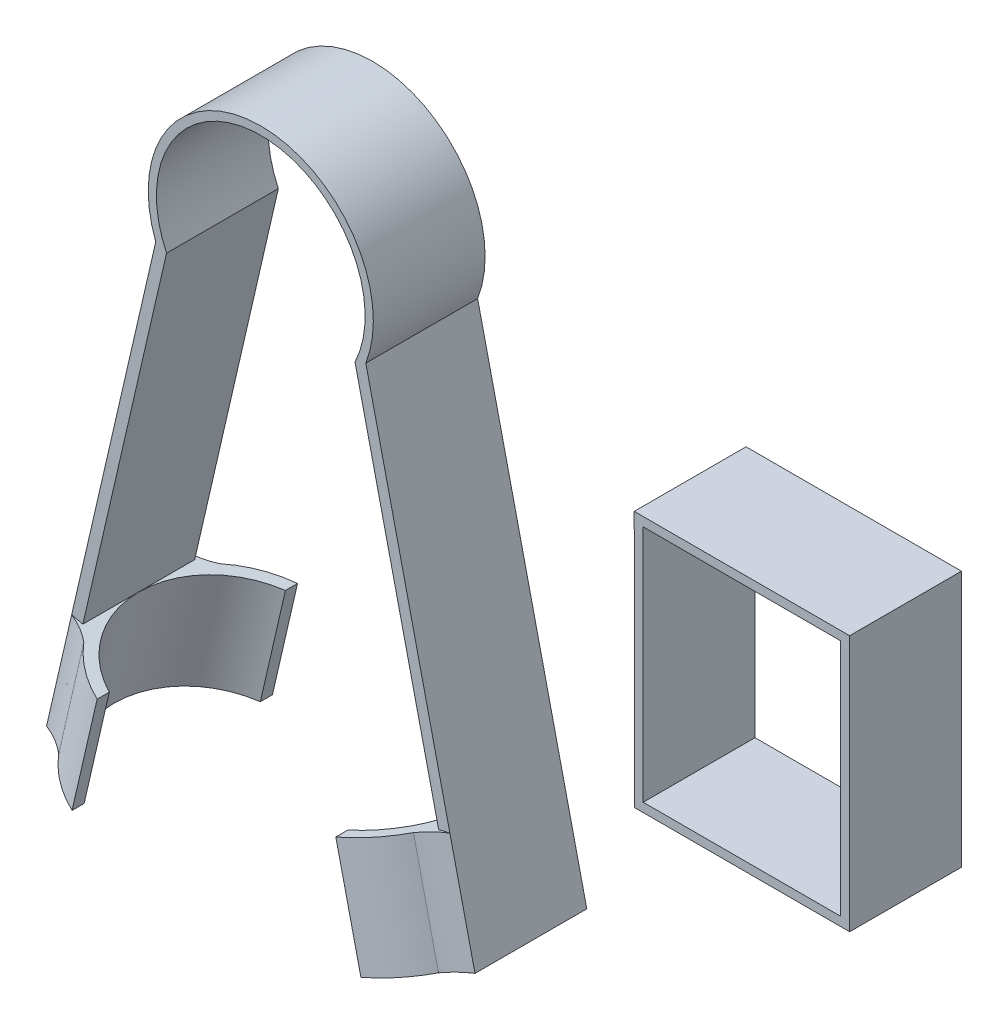
from build123d import *

# Parameters (mm, degrees)
BOSS_EXTRUDE1_DEPTH = 15
SKETCH2_W           = 1.545443363
SKETCH2_H           = 15
BOSS_EXTRUDE2_DEPTH = 15
SKETCH3_W           = 1.545443364
SKETCH3_H           = 15
BOSS_EXTRUDE3_DEPTH = 15
SKETCH4_W           = 26.5
SKETCH4_H           = 32
BOSS_EXTRUDE4_DEPTH = 15


with BuildPart() as part:
    # Sketch1 → Boss-Extrude1 (new body)
    with BuildSketch(Plane.XY):
        with BuildLine():
            ThreePointArc((17.78047381, -1.842873049), (3.687593803, 18.679371239), (-10.405286203, -1.842873049))
            Line((-10.405286203, -1.842873049), (-21.685752651, -50.81039406))
            Line((-21.685752651, -50.81039406), (-20.179753399, -51.157325529))
            Line((-20.179753399, -51.157325529), (-8.95541876, -2.433467801))
            ThreePointArc((-8.95541876, -2.433467801), (3.687593803, 17.579371239), (16.330606367, -2.433467801))
            Line((16.330606367, -2.433467801), (27.554941006, -51.157325529))
            Line((27.554941006, -51.157325529), (29.060940258, -50.81039406))
            Line((29.060940258, -50.81039406), (17.78047381, -1.842873049))
        make_face()
    extrude(amount=BOSS_EXTRUDE1_DEPTH)

    # Sketch2 → Boss-Extrude2 (add)
    with BuildSketch(Plane(origin=(12.579642201, -54.607129649, 0), x_dir=(0.9744771545600535, 0.22448669279167044, 0), z_dir=(0.22448669279167044, -0.9744771545600535, 0))):
        with BuildLine():
            add(Edge.make_bspline(
                [(16.912965049, 0), (15.069776896, -0.453122882), (13.567239051, -1.630176533)],
                knots=[0, 0, 0, 1, 1, 1], degree=2))
            ThreePointArc((13.567239051, -1.630176533), (10.730447914, -4.213314865), (7.306496901, -5.944368606))
            Line((7.306496901, -5.944368606), (7.306496901, -4.319070277))
            ThreePointArc((7.306496901, -4.319070277), (15.358962309, 7.5), (7.306496901, 19.319070277))
            Line((7.306496901, 19.319070277), (7.306496901, 20.944368606))
            ThreePointArc((7.306496901, 20.944368606), (10.730447914, 19.213314865), (13.567239051, 16.630176533))
            add(Edge.make_bspline(
                [(16.912965049, 15), (15.069776896, 15.453122882), (13.567239051, 16.630176533)],
                knots=[0, 0, 0, 1, 1, 1], degree=2))
            Line((16.912965049, 15), (15.367521686, 15))
            Line((15.367521686, 15), (15.367521686, 0))
            Line((15.367521686, 0), (16.912965049, 0))
        make_face()
        with Locations((16.140243368, 7.5)):
            Rectangle(SKETCH2_W, SKETCH2_H)
    extrude(amount=BOSS_EXTRUDE2_DEPTH)

    # Sketch3 → Boss-Extrude3 (add)
    with BuildSketch(Plane(origin=(-12.207974967, -52.993754601, 0), x_dir=(0.9744771545600535, -0.22448669279167044, 0), z_dir=(-0.22448669279167044, -0.9744771545600535, 0))):
        with Locations((-8.953291534, 7.5)):
            Rectangle(SKETCH3_W, SKETCH3_H)
        with BuildLine():
            add(Edge.make_bspline(
                [(-9.726013216, 15), (-7.882825063, 15.453122882), (-6.380287218, 16.630176533)],
                knots=[0, 0, 0, 1, 1, 1], degree=2))
            ThreePointArc((-6.380287218, 16.630176533), (-3.543496081, 19.213314865), (-0.119545067, 20.944368606))
            Line((-0.119545067, 20.944368606), (-0.119545067, 19.319070277))
            ThreePointArc((-0.119545067, 19.319070277), (-8.172010476, 7.5), (-0.119545067, -4.319070277))
            Line((-0.119545067, -4.319070277), (-0.119545067, -5.944368606))
            ThreePointArc((-0.119545067, -5.944368606), (-3.543496081, -4.213314865), (-6.380287218, -1.630176533))
            add(Edge.make_bspline(
                [(-9.726013216, 0), (-7.882825063, -0.453122882), (-6.380287218, -1.630176533)],
                knots=[0, 0, 0, 1, 1, 1], degree=2))
            Line((-9.726013216, 0), (-8.180569852, 0))
            Line((-8.180569852, 0), (-8.180569852, 15))
            Line((-8.180569852, 15), (-9.726013216, 15))
        make_face()
    extrude(amount=BOSS_EXTRUDE3_DEPTH)


with BuildPart() as body_2:
    # Sketch4 → Boss-Extrude4 (new body)
    with BuildSketch(Plane.XY):
        Polygon((53.791493567, -1.057863552), (82.691493567, -1.057863552), (82.691493567, -35.457839056), (53.832546045, -35.457839056), align=None)
        with Locations((68.241493537, -18.257839056)):
            Rectangle(SKETCH4_W, SKETCH4_H, mode=Mode.SUBTRACT)
    extrude(amount=BOSS_EXTRUDE4_DEPTH)


solid = Compound([part.part, body_2.part])
